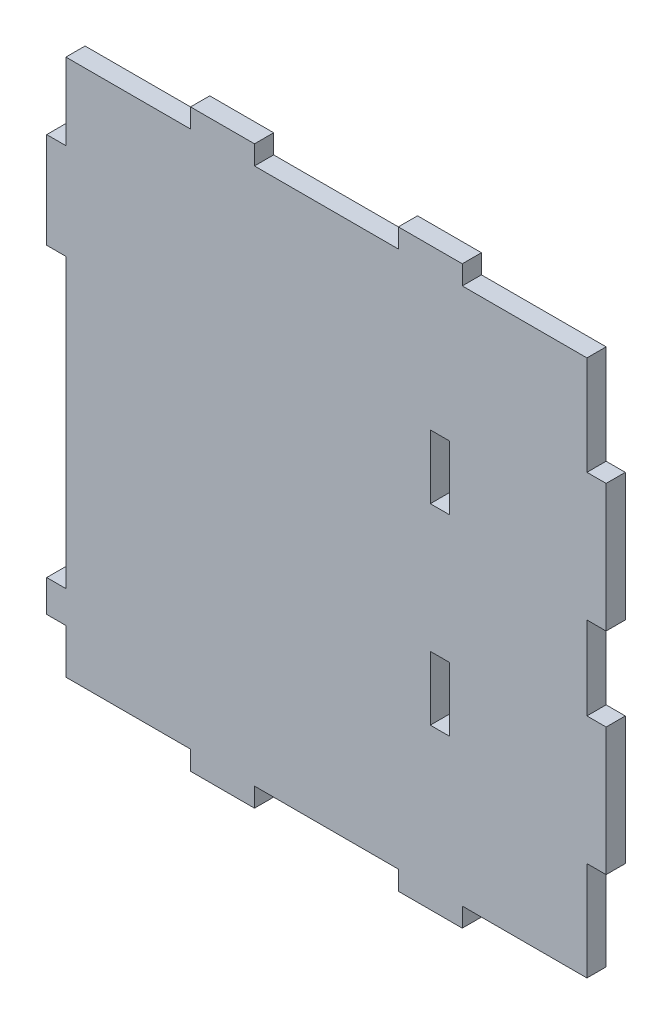
from build123d import *

# Parameters (mm, degrees)
ESQUISSE1_W                  = 175
ESQUISSE1_H                  = 180
BOSS_EXTRU_1_DEPTH           = 6
ESQUISSE2_W                  = 6
ESQUISSE2_H                  = 26
ESQUISSE2_W_2                = 45
ESQUISSE2_H_2                = 6
ESQUISSE2_H_3                = 90
ENL_V_MAT_ENCOCHE_DEPTH      = 252.119493469
ESQUISSE3_W                  = 6
ESQUISSE3_H                  = 20
ENL_V_MAT_ENCOCHE_TAGE_DEPTH = 6


with BuildPart() as part:
    # Esquisse1 → Boss.-Extru.1 (new body)
    with BuildSketch(Plane.XY):
        with Locations((-87.5, 90)):
            Rectangle(ESQUISSE1_W, ESQUISSE1_H)
    extrude(amount=BOSS_EXTRU_1_DEPTH)

    # Esquisse2 → Enl_v. mat encoche (cut, through all)
    with BuildSketch(Plane.XY.offset(6)):
        Polygon((0, 180), (-6, 180), (-45, 180), (-45, 174), (-6, 174), (-6, 143), (0, 143), align=None)
        with Locations((-3, 90)):
            Rectangle(ESQUISSE2_W, ESQUISSE2_H)
        Polygon((0, 0), (-6, 0), (-45, 0), (-45, 6), (-6, 6), (-6, 37), (0, 37), align=None)
        Polygon((-175, 0), (-130, 0), (-130, 6), (-169, 6), (-169, 20), (-175, 20), (-175, 6), align=None)
        with Locations((-87.5, 3)):
            Rectangle(ESQUISSE2_W_2, ESQUISSE2_H_2)
        Polygon((-175, 174), (-175, 150), (-169, 150), (-169, 174), (-130, 174), (-130, 180), (-175, 180), align=None)
        with Locations((-172, 75)):
            Rectangle(ESQUISSE2_W, ESQUISSE2_H_3)
        with Locations((-87.5, 177)):
            Rectangle(ESQUISSE2_W_2, ESQUISSE2_H_2)
    extrude(amount=-ENL_V_MAT_ENCOCHE_DEPTH, mode=Mode.SUBTRACT)

    # Esquisse3 → Enlèv. mat encoche étage (cut)
    with BuildSketch(Plane.XY.offset(6)):
        with Locations((-52, 120)):
            Rectangle(ESQUISSE3_W, ESQUISSE3_H)
        with Locations((-52, 60)):
            Rectangle(ESQUISSE3_W, ESQUISSE3_H)
    extrude(amount=-ENL_V_MAT_ENCOCHE_TAGE_DEPTH, mode=Mode.SUBTRACT)


solid = part.part
